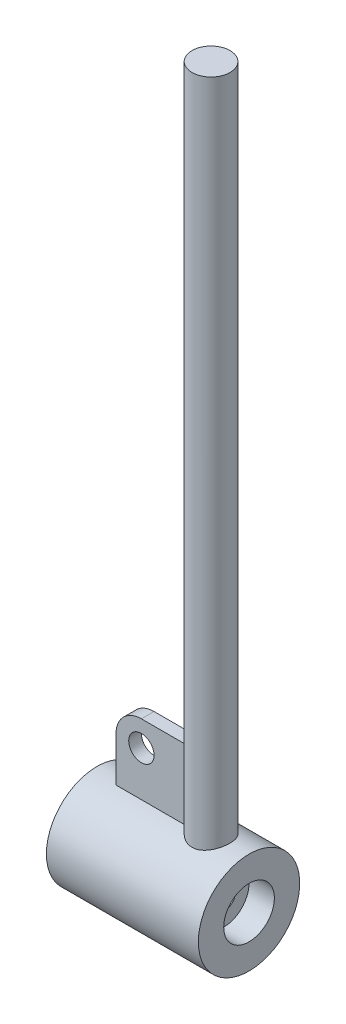
from build123d import *

# Parameters (mm, degrees)
SKETCH3_R                       = 4.7625
BOSS_EXTRUDE1_DEPTH             = 150
BOSS_EXTRUDE1_DIRECTION_2_REACH = 54.926
BOSS_EXTRUDE2_DEPTH             = 1.5875
SKETCH5_R                       = 3.175
CUT_EXTRUDE1_DEPTH              = 183.813192428


with BuildPart() as part:
    # Sketch1 → Revolve1 (revolve)
    with BuildSketch(Plane.XY, mode=Mode.PRIVATE) as revolve1_sk:
        Polygon((-28.575, 12.7), (9.525, 12.7), (9.525, 6.35), (3.175, 6.35), (3.175, 3.01625), (-15.875, 3.01625), (-15.875, 6.35), (-28.575, 6.35), align=None)
    revolve(revolve1_sk.sketch.rotate(Axis((-58.643350072, 0, 0), (1, 0, 0)), 90), axis=Axis((-58.643350072, 0, 0), (1, 0, 0)))

    # Sketch3 → Boss-Extrude1 (add)
    with BuildSketch(Plane(origin=(0, 30, 0), x_dir=(-1, 0, 0), z_dir=(0, 1, 0))):
        with Locations(Location((0, 0, 0), (0, 0, 90))):
            Circle(SKETCH3_R)
    extrude(amount=BOSS_EXTRUDE1_DEPTH)

    # Sketch3 → Boss-Extrude1 direction 2 (add, up to next)
    with BuildSketch(Plane(origin=(0, 30, 0), x_dir=(-1, 0, 0), z_dir=(0, 1, 0)), mode=Mode.PRIVATE) as boss_extrude1_direction_2_sk1:
        with Locations(Location((0, 0, 0), (0, 0, 90))):
            Circle(SKETCH3_R)
    boss_extrude1_direction_2_tool1 = extrude(boss_extrude1_direction_2_sk1.sketch, amount=-BOSS_EXTRUDE1_DIRECTION_2_REACH, mode=Mode.PRIVATE) - part.part
    add(boss_extrude1_direction_2_tool1.solids().sort_by_distance((0, 30, 0))[0])

    # Sketch4 → Boss-Extrude2 (add, symmetric)
    with BuildSketch(Plane.XY):
        with BuildLine():
            Line((-3.175, 11.1125), (-22.225, 11.1125))
            Line((-22.225, 11.1125), (-22.225, 23.8125))
            ThreePointArc((-22.225, 23.8125), (-20.365128061, 28.302628061), (-15.875, 30.1625))
            Line((-15.875, 30.1625), (-3.175, 30.1625))
            Line((-3.175, 30.1625), (-3.175, 11.1125))
        make_face()
    extrude(amount=BOSS_EXTRUDE2_DEPTH, both=True)

    # Sketch5 → Cut-Extrude1 (cut, through all)
    with BuildSketch(Plane.XY.offset(1.5875)):
        with Locations((-15.875, 23.8125)):
            Circle(SKETCH5_R)
    extrude(amount=-CUT_EXTRUDE1_DEPTH, mode=Mode.SUBTRACT)


solid = part.part
